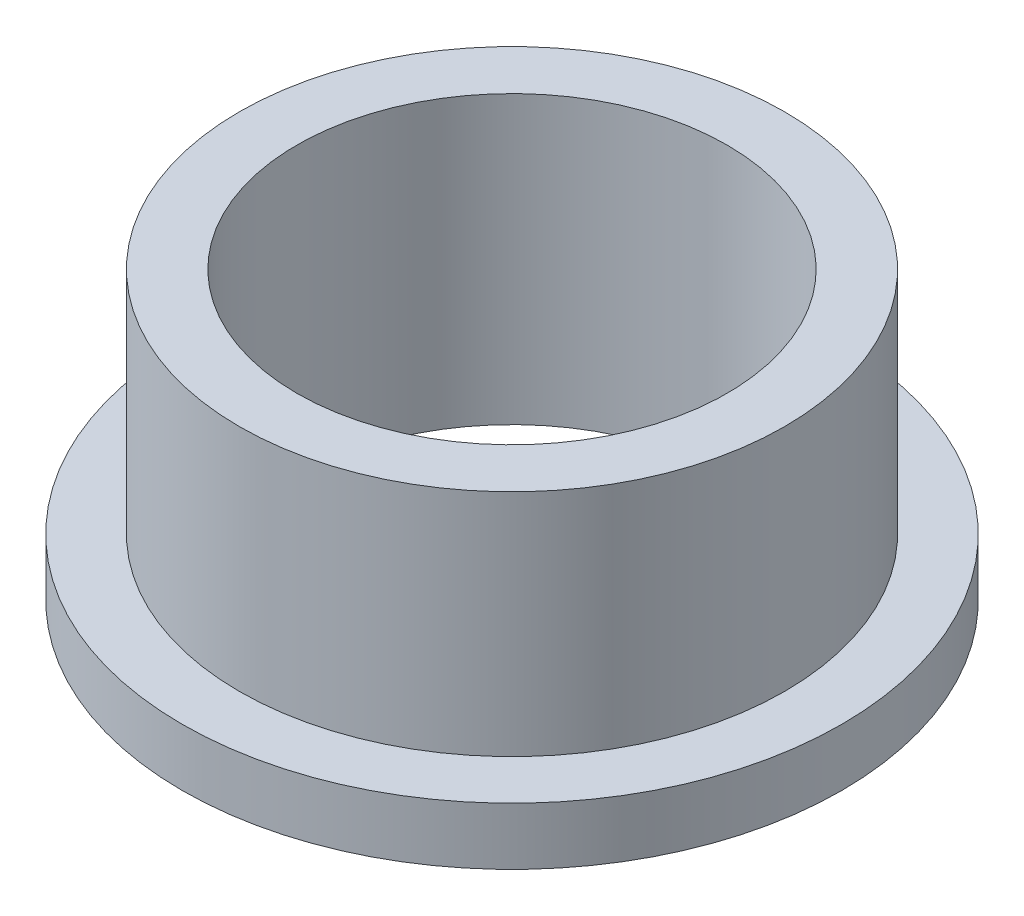
from build123d import *

# Parameters (mm, degrees)
SKETCH2_R           = 19.02
SKETCH2_R_2         = 15.005
BOSS_EXTRUDE1_DEPTH = 20
SKETCH3_R           = 23
SKETCH3_R_2         = 19.02
BOSS_EXTRUDE2_DEPTH = 4


with BuildPart() as part:
    # Sketch2 → Boss-Extrude1 (new body)
    with BuildSketch(Plane(origin=(0, 0, 0), x_dir=(1, 0, 0), z_dir=(0, 1, 0))):
        with Locations(Location((0, 0, 0), (0, 0, 270))):
            Circle(SKETCH2_R)
        with Locations(Location((0, 0, 0), (0, 0, 270))):
            Circle(SKETCH2_R_2, mode=Mode.SUBTRACT)
    extrude(amount=BOSS_EXTRUDE1_DEPTH)

    # Sketch3 → Boss-Extrude2 (add)
    with BuildSketch(Plane(origin=(0, 0, 0), x_dir=(1, 0, 0), z_dir=(0, 1, 0))):
        with Locations(Location((0, 0, 0), (0, 0, 270))):
            Circle(SKETCH3_R)
        with Locations(Location((0, 0, 0), (0, 0, 270))):
            Circle(SKETCH3_R_2, mode=Mode.SUBTRACT)
    extrude(amount=BOSS_EXTRUDE2_DEPTH)


solid = part.part
